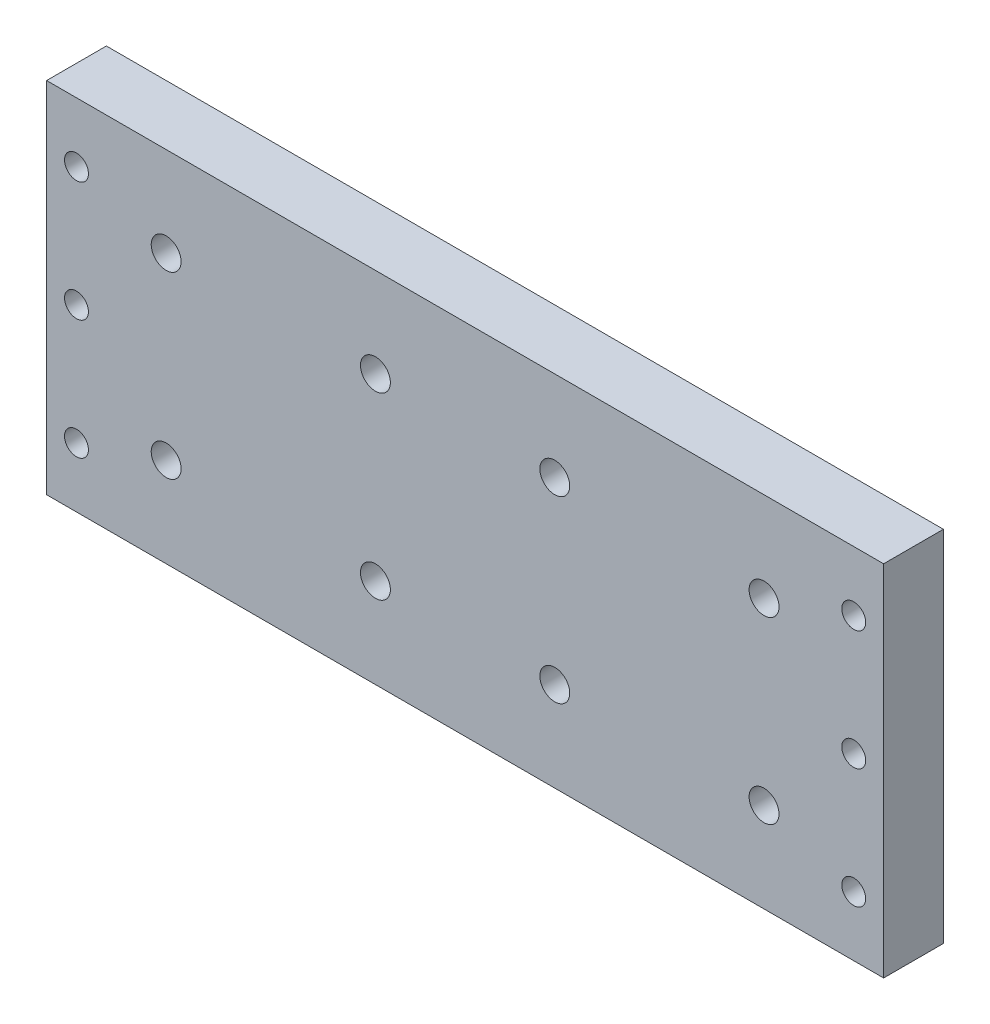
from build123d import *

# Parameters (mm, degrees)
SKETCH_1_W      = 140
SKETCH_1_H      = 60
SKETCH_1_R      = 2
SKETCH_1_R_2    = 2.5
EXTRUDE_1_DEPTH = 10


with BuildPart() as part:
    # Эскиз1 → Бобышка-Вытянуть1 (new body)
    with BuildSketch(Plane.XY):
        Rectangle(SKETCH_1_W, SKETCH_1_H)
        with Locations((-65, 0)):
            Circle(SKETCH_1_R, mode=Mode.SUBTRACT)
        with Locations((-65, 20)):
            Circle(SKETCH_1_R, mode=Mode.SUBTRACT)
        with Locations((-65, -20)):
            Circle(SKETCH_1_R, mode=Mode.SUBTRACT)
        with Locations(Location((65, -20, 0), (0, 0, 180))):
            Circle(SKETCH_1_R, mode=Mode.SUBTRACT)
        with Locations(Location((65, 20, 0), (0, 0, 180))):
            Circle(SKETCH_1_R, mode=Mode.SUBTRACT)
        with Locations(Location((65, 0, 0), (0, 0, 180))):
            Circle(SKETCH_1_R, mode=Mode.SUBTRACT)
        with Locations((-50, 15)):
            Circle(SKETCH_1_R_2, mode=Mode.SUBTRACT)
        with Locations((-50, -15)):
            Circle(SKETCH_1_R_2, mode=Mode.SUBTRACT)
        with Locations((-15, 15)):
            Circle(SKETCH_1_R_2, mode=Mode.SUBTRACT)
        with Locations((-15, -15)):
            Circle(SKETCH_1_R_2, mode=Mode.SUBTRACT)
        with Locations(Location((15, -15, 0), (0, 0, 180))):
            Circle(SKETCH_1_R_2, mode=Mode.SUBTRACT)
        with Locations(Location((15, 15, 0), (0, 0, 180))):
            Circle(SKETCH_1_R_2, mode=Mode.SUBTRACT)
        with Locations(Location((50, -15, 0), (0, 0, 180))):
            Circle(SKETCH_1_R_2, mode=Mode.SUBTRACT)
        with Locations(Location((50, 15, 0), (0, 0, 180))):
            Circle(SKETCH_1_R_2, mode=Mode.SUBTRACT)
    extrude(amount=EXTRUDE_1_DEPTH)


solid = part.part
